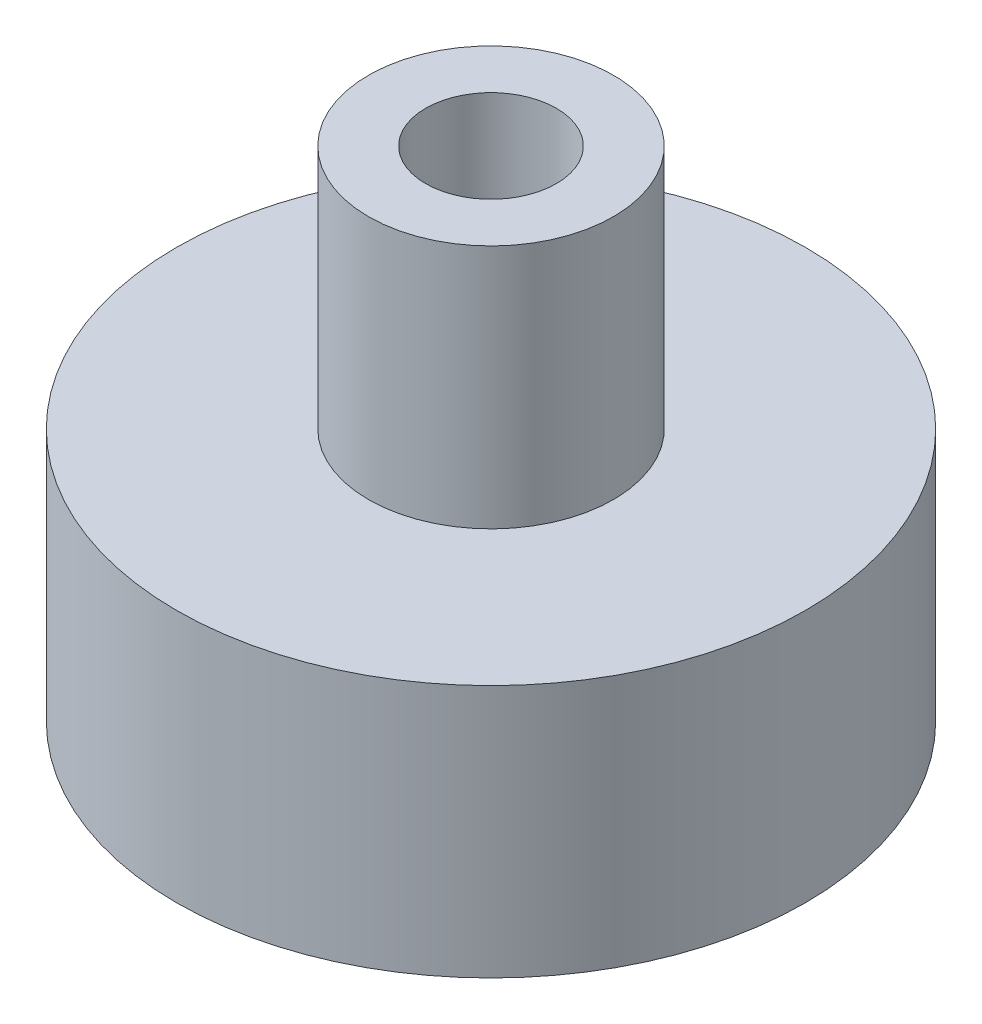
from build123d import *

# Parameters (mm, degrees)
SKETCH1_R               = 3.85
BOSS_EXTRUDE1_DEPTH     = 3.1
SKETCH2_R               = 1.5
SKETCH2_R_2             = 0.8
BOSS_EXTRUDE2_DEPTH     = 3
CUT_EXTRUDE1_DEPTH      = 7.265381074
CUT_EXTRUDE1_DEPTH_BACK = 7.265381074
SKETCH3_R               = 0.8
SKETCH4_R               = 2.65
CUT_EXTRUDE2_DEPTH      = 2.2


with BuildPart() as part:
    # Sketch1 → Boss-Extrude1 (new body)
    with BuildSketch(Plane(origin=(0, 0, 0), x_dir=(1, 0, 0), z_dir=(0, 1, 0))):
        with Locations(Location((0, 0, 0), (0, 0, 90))):
            Circle(SKETCH1_R)
    extrude(amount=BOSS_EXTRUDE1_DEPTH)

    # Sketch2 → Boss-Extrude2 (add)
    with BuildSketch(Plane(origin=(0, 3.1, 0), x_dir=(1, 0, 0), z_dir=(0, 1, 0))):
        with Locations(Location((0, 0, 0), (0, 0, 270))):
            Circle(SKETCH2_R)
        with Locations(Location((0, 0, 0), (0, 0, 270))):
            Circle(SKETCH2_R_2, mode=Mode.SUBTRACT)
    extrude(amount=BOSS_EXTRUDE2_DEPTH)

    # Sketch3 → Cut-Extrude1 (cut, two sides: drawn at the far end of the back side and taken through both)
    with BuildSketch(Plane(origin=(0, 3.1, 0), x_dir=(1, 0, 0), z_dir=(0, 1, 0)).offset(-CUT_EXTRUDE1_DEPTH_BACK)):
        with Locations(Location((0, 0, 0), (0, 0, 270))):
            Circle(SKETCH3_R)
    extrude(amount=CUT_EXTRUDE1_DEPTH + CUT_EXTRUDE1_DEPTH_BACK, mode=Mode.SUBTRACT)

    # Sketch4 → Cut-Extrude2 (cut)
    with BuildSketch(Plane.XZ):
        with Locations(Location((0, 0, 0), (0, 0, 270))):
            Circle(SKETCH4_R)
    extrude(amount=-CUT_EXTRUDE2_DEPTH, mode=Mode.SUBTRACT)


solid = part.part
